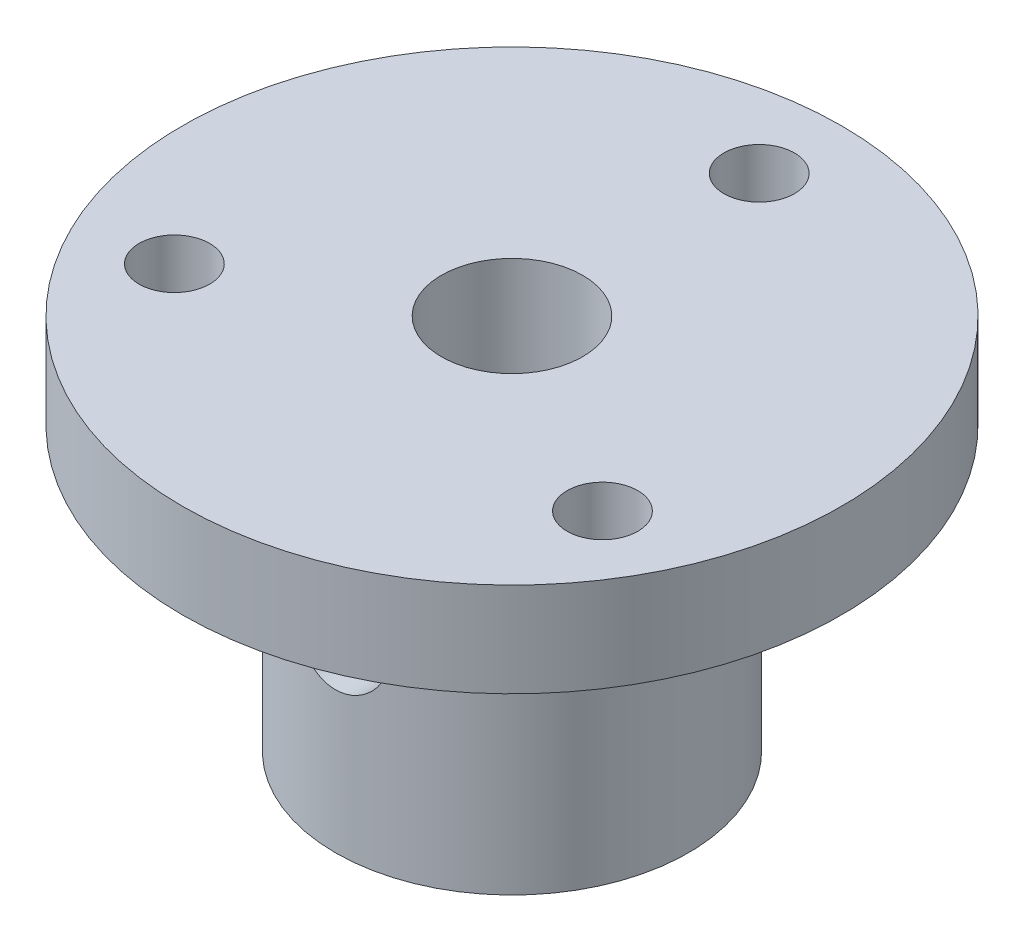
from build123d import *

# Parameters (mm, degrees)
ESQUISSE2_R             = 1.5
ENL_V_MAT_EXTRU_1_DEPTH = 26.455844123
ESQUISSE3_R             = 2
ENL_V_MAT_EXTRU_2_DEPTH = 26.455844123


with BuildPart() as part:
    # Esquisse1 → Révolution1 (revolve)
    with BuildSketch(Plane.XY, mode=Mode.PRIVATE) as r_volution1_sk:
        Polygon((-3, 0), (-3, 16), (-14, 16), (-14, 12), (-7.5, 12), (-7.5, 0), align=None)
    revolve(r_volution1_sk.sketch.rotate(Axis((0, 0, 0), (0, 1, 0)), 270), axis=Axis((0, 0, 0), (0, 1, 0)))

    # Esquisse2 → Enlèv. mat.-Extru.1 (cut, through all)
    with BuildSketch(Plane(origin=(0, 16, 0), x_dir=(1, 0, 0), z_dir=(0, 1, 0))):
        with Locations(Location((9.09326674, -5.25, 0), (0, 0, 270))):
            Circle(ESQUISSE2_R)
        with Locations(Location((-9.09326674, -5.25, 0), (0, 0, 270))):
            Circle(ESQUISSE2_R)
        with Locations(Location((0, 10.5, 0), (0, 0, 270))):
            Circle(ESQUISSE2_R)
    extrude(amount=-ENL_V_MAT_EXTRU_1_DEPTH, mode=Mode.SUBTRACT)

    # Esquisse3 → Enlèv. mat.-Extru.2 (cut, through all)
    with BuildSketch(Plane.XY):
        with Locations(Location((0, 8, 0), (0, 0, 180))):
            Circle(ESQUISSE3_R)
    extrude(amount=ENL_V_MAT_EXTRU_2_DEPTH, mode=Mode.SUBTRACT)


solid = part.part
